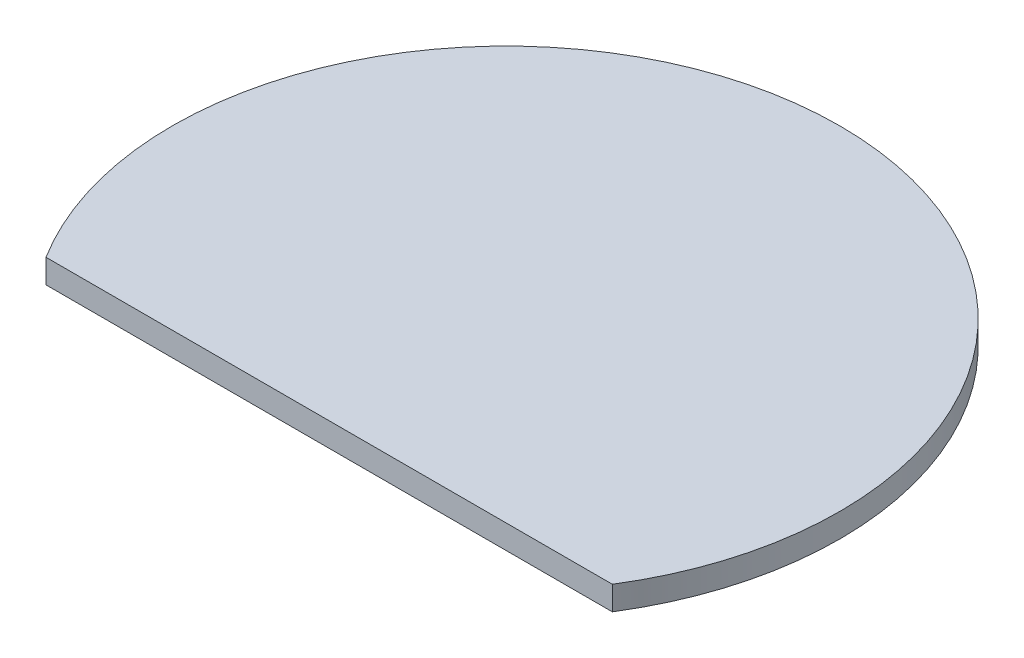
from build123d import *

# Parameters (mm, degrees)
BOSS_EXTRUDE1_DEPTH = 1


with BuildPart() as part:
    # Sketch1 → Boss-Extrude1 (new body)
    with BuildSketch(Plane(origin=(0, 0, 0), x_dir=(1, 0, 0), z_dir=(0, 1, 0))):
        with BuildLine():
            Line((-11.84, -7.395674411), (11.84, -7.395674411))
            ThreePointArc((11.84, -7.395674411), (0, 13.96), (-11.84, -7.395674411))
        make_face()
    extrude(amount=BOSS_EXTRUDE1_DEPTH)


solid = part.part
